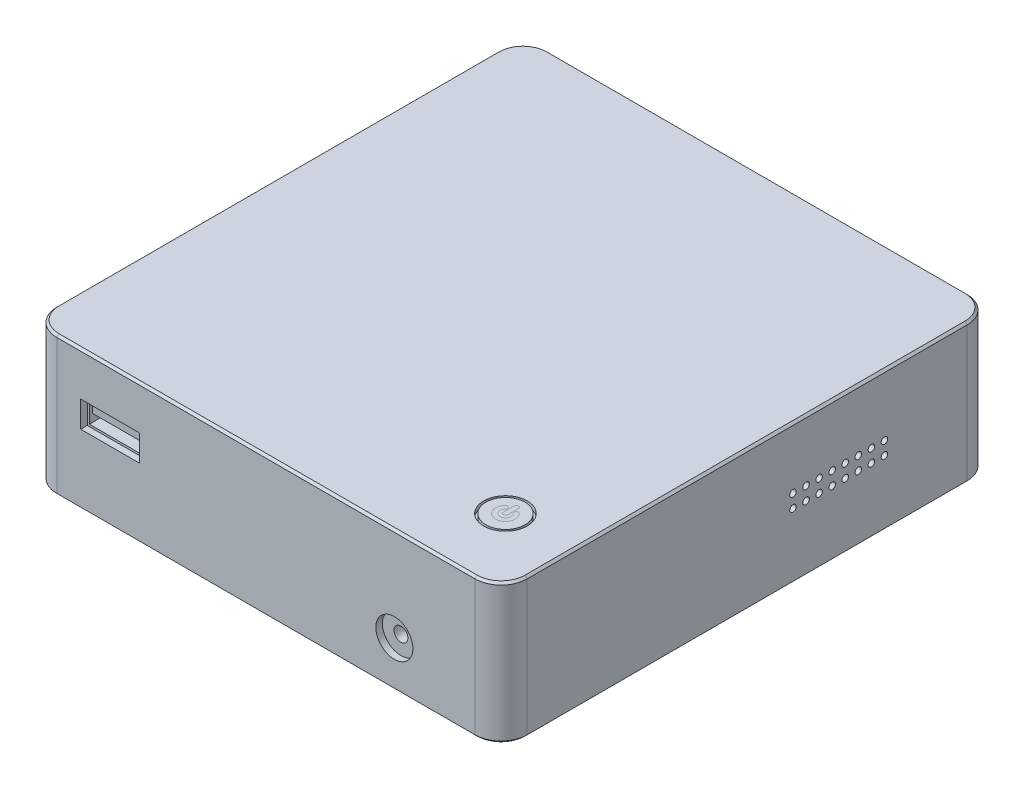
from build123d import *

# Parameters (mm, degrees)
EXTRUDE_1_DEPTH           = 32
SKETCH_2_R                = 5
SKETCH_2_R_2              = 4.5
CUT_EXTRUDE_1_DEPTH       = 1
SKETCH_4_R                = 0.75
CUT_EXTRUDE_2_DEPTH       = 3
SKETCH_5_R                = 4.25
SKETCH_5_W                = 13.5
SKETCH_5_H                = 6
CUT_EXTRUDE_3_DEPTH       = 1.5
SKETCH_6_R                = 1.6
SKETCH_6_W                = 12.5
SKETCH_6_H                = 5
SKETCH_6_W_2              = 11
SKETCH_6_H_2              = 2
CUT_EXTRUDE_4_DEPTH       = 10
SKETCH_7_W                = 13.5
SKETCH_7_H                = 6
CUT_EXTRUDE_5_DEPTH       = 1.5
SKETCH_8_W                = 12.5
SKETCH_8_H                = 5
SKETCH_8_W_2              = 11
SKETCH_8_H_2              = 2
CUT_EXTRUDE_6_DEPTH       = 10
SKETCH_9_R                = 5
CUT_EXTRUDE_7_DEPTH       = 1.5
SKETCH_10_R               = 3.25
SKETCH_10_R_2             = 1.25
SKETCH_10_W               = 7
SKETCH_10_H               = 2
CUT_EXTRUDE_8_DEPTH       = 10
SKETCH_11_W               = 1
SKETCH_11_H               = 8.8
CUT_EXTRUDE_9_DEPTH       = 10
HOLE_WIZARD_M3_1_D        = 2.5
HOLE_WIZARD_M3_1_DEPTH    = 7.5
HOLE_WIZARD_M3_1_TIP      = 0.751075774
SKETCH_14_R               = 5.5
EXTRUDE_2_DEPTH           = 2
EXTRUDE_2_DRAFT           = 10
EXTRUDE_2_PROFILE_2_DEPTH = 2
EXTRUDE_2_PROFILE_2_DRAFT = 10
EXTRUDE_2_PROFILE_3_DEPTH = 2
EXTRUDE_2_PROFILE_3_DRAFT = 10
EXTRUDE_2_PROFILE_4_DEPTH = 2
EXTRUDE_2_PROFILE_4_DRAFT = 10
CHAMFER_1_SIZE            = 0.5


with BuildPart() as part:
    # 草图1 → 凸台-拉伸1 (new body)
    with BuildSketch(Plane(origin=(0, 0, 0), x_dir=(1, 0, 0), z_dir=(0, 1, 0))):
        with BuildLine():
            Line((-48, -56.5), (48, -56.5))
            ThreePointArc((48, -56.5), (52.242640687, -54.742640687), (54, -50.5))
            Line((54, -50.5), (54, 50.5))
            ThreePointArc((54, 50.5), (52.242640687, 54.742640687), (48, 56.5))
            Line((48, 56.5), (-48, 56.5))
            ThreePointArc((-48, 56.5), (-52.242640687, 54.742640687), (-54, 50.5))
            Line((-54, 50.5), (-54, -50.5))
            ThreePointArc((-54, -50.5), (-52.242640687, -54.742640687), (-48, -56.5))
        make_face()
    extrude(amount=EXTRUDE_1_DEPTH)

    # 草图2 → 切除-拉伸1 (cut)
    with BuildSketch(Plane(origin=(0, 32, 0), x_dir=(1, 0, 0), z_dir=(0, 1, 0))):
        with Locations(Location((39, -40.5, 0), (0, 0, 270))):
            Circle(SKETCH_2_R)
        with Locations(Location((39, -40.5, 0), (0, 0, 270))):
            Circle(SKETCH_2_R_2, mode=Mode.SUBTRACT)
    extrude(amount=-CUT_EXTRUDE_1_DEPTH, mode=Mode.SUBTRACT)

    # 草图4 → 切除-拉伸2 (cut)
    with BuildSketch(Plane(origin=(54, 0, 0), x_dir=(0, 0, -1), z_dir=(1, 0, 0))):
        with Locations((10.5, 18)):
            Circle(SKETCH_4_R)
        with Locations((13.5, 18)):
            Circle(SKETCH_4_R)
        with Locations((16.5, 18)):
            Circle(SKETCH_4_R)
        with Locations((19.5, 18)):
            Circle(SKETCH_4_R)
        with Locations((22.5, 18)):
            Circle(SKETCH_4_R)
        with Locations((25.5, 18)):
            Circle(SKETCH_4_R)
        with Locations((28.5, 18)):
            Circle(SKETCH_4_R)
        with Locations((31.5, 18)):
            Circle(SKETCH_4_R)
        with Locations((13.5, 15)):
            Circle(SKETCH_4_R)
        with Locations((16.5, 15)):
            Circle(SKETCH_4_R)
        with Locations((19.5, 15)):
            Circle(SKETCH_4_R)
        with Locations((22.5, 15)):
            Circle(SKETCH_4_R)
        with Locations((25.5, 15)):
            Circle(SKETCH_4_R)
        with Locations((28.5, 15)):
            Circle(SKETCH_4_R)
        with Locations((31.5, 15)):
            Circle(SKETCH_4_R)
        with Locations((10.5, 15)):
            Circle(SKETCH_4_R)
    extrude(amount=-CUT_EXTRUDE_2_DEPTH, mode=Mode.SUBTRACT)

    # 草图5 → 切除-拉伸3 (cut)
    with BuildSketch(Plane.XY.offset(56.5)):
        with Locations((29.5, 10.5)):
            Circle(SKETCH_5_R)
        with Locations((-35.75, 19)):
            Rectangle(SKETCH_5_W, SKETCH_5_H)
    extrude(amount=-CUT_EXTRUDE_3_DEPTH, mode=Mode.SUBTRACT)

    # 草图6 → 切除-拉伸4 (cut)
    # profile 1 of 2: a face of its own
    with BuildSketch(Plane.XY.offset(55)):
        with Locations((29.5, 10.5)):
            Circle(SKETCH_6_R)
    # profile 2 of 2: a face of its own
    with BuildSketch(Plane.XY.offset(55)):
        with Locations((-35.75, 19)):
            Rectangle(SKETCH_6_W, SKETCH_6_H)
        with Locations((-35.75, 20)):
            Rectangle(SKETCH_6_W_2, SKETCH_6_H_2, mode=Mode.SUBTRACT)
    extrude(amount=-CUT_EXTRUDE_4_DEPTH, mode=Mode.SUBTRACT)

    # 草图7 → 切除-拉伸5 (cut)
    with BuildSketch(Plane.ZY.offset(54)):
        with Locations((3.25, 19)):
            Rectangle(SKETCH_7_W, SKETCH_7_H)
        with Locations((25.75, 19)):
            Rectangle(SKETCH_7_W, SKETCH_7_H)
    extrude(amount=-CUT_EXTRUDE_5_DEPTH, mode=Mode.SUBTRACT)

    # 草图8 → 切除-拉伸6 (cut)
    # profile 1 of 2: a face of its own
    with BuildSketch(Plane.ZY.offset(52.5)):
        with Locations((3.25, 19)):
            Rectangle(SKETCH_8_W, SKETCH_8_H)
        with Locations((3.25, 20)):
            Rectangle(SKETCH_8_W_2, SKETCH_8_H_2, mode=Mode.SUBTRACT)
    # profile 2 of 2: a face of its own
    with BuildSketch(Plane.ZY.offset(52.5)):
        with Locations((25.75, 19)):
            Rectangle(SKETCH_8_W, SKETCH_8_H)
        with Locations((25.75, 20)):
            Rectangle(SKETCH_8_W_2, SKETCH_8_H_2, mode=Mode.SUBTRACT)
    extrude(amount=-CUT_EXTRUDE_6_DEPTH, mode=Mode.SUBTRACT)

    # 草图9 → 切除-拉伸7 (cut)
    with BuildSketch(Plane(origin=(0, 0, -56.5), x_dir=(-1, 0, 0), z_dir=(0, 0, -1))):
        with Locations((-39, 9.5)):
            Circle(SKETCH_9_R)
        with BuildLine():
            Line((-27.5, 7), (-14.5, 7))
            ThreePointArc((-14.5, 7), (-13.792893219, 7.292893219), (-13.5, 8))
            Line((-13.5, 8), (-13.5, 9.585786438))
            ThreePointArc((-13.5, 9.585786438), (-13.576120467, 9.96846987), (-13.792893219, 10.292893219))
            Line((-13.792893219, 10.292893219), (-15.707106781, 12.207106781))
            ThreePointArc((-15.707106781, 12.207106781), (-16.03153013, 12.423879533), (-16.414213562, 12.5))
            Line((-16.414213562, 12.5), (-25.585786438, 12.5))
            ThreePointArc((-25.585786438, 12.5), (-25.96846987, 12.423879533), (-26.292893219, 12.207106781))
            Line((-26.292893219, 12.207106781), (-28.207106781, 10.292893219))
            ThreePointArc((-28.207106781, 10.292893219), (-28.423879533, 9.96846987), (-28.5, 9.585786438))
            Line((-28.5, 9.585786438), (-28.5, 8))
            ThreePointArc((-28.5, 8), (-28.207106781, 7.292893219), (-27.5, 7))
        make_face()
        with BuildLine():
            Line((-44.8, 23), (-39.8, 23))
            ThreePointArc((-39.8, 23), (-39.092893219, 22.707106781), (-38.8, 22))
            Line((-38.8, 22), (-38.8, 21))
            ThreePointArc((-38.8, 21), (-39.092893219, 20.292893219), (-39.8, 20))
            Line((-39.8, 20), (-44.8, 20))
            ThreePointArc((-44.8, 20), (-45.507106781, 20.292893219), (-45.8, 21))
            Line((-45.8, 21), (-45.8, 22))
            ThreePointArc((-45.8, 22), (-45.507106781, 22.707106781), (-44.8, 23))
        make_face()
        with BuildLine():
            Line((-36, 26.5), (-9.5, 26.5))
            ThreePointArc((-9.5, 26.5), (-8.792893219, 26.207106781), (-8.5, 25.5))
            Line((-8.5, 25.5), (-8.5, 18.7))
            ThreePointArc((-8.5, 18.7), (-8.792893219, 17.992893219), (-9.5, 17.7))
            Line((-9.5, 17.7), (-36, 17.7))
            ThreePointArc((-36, 17.7), (-36.707106781, 17.992893219), (-37, 18.7))
            Line((-37, 18.7), (-37, 25.5))
            ThreePointArc((-37, 25.5), (-36.707106781, 26.207106781), (-36, 26.5))
        make_face()
        with BuildLine():
            Line((-5.5, 26.5), (21, 26.5))
            ThreePointArc((21, 26.5), (21.707106781, 26.207106781), (22, 25.5))
            Line((22, 25.5), (22, 18.7))
            ThreePointArc((22, 18.7), (21.707106781, 17.992893219), (21, 17.7))
            Line((21, 17.7), (-5.5, 17.7))
            ThreePointArc((-5.5, 17.7), (-6.207106781, 17.992893219), (-6.5, 18.7))
            Line((-6.5, 18.7), (-6.5, 25.5))
            ThreePointArc((-6.5, 25.5), (-6.207106781, 26.207106781), (-5.5, 26.5))
        make_face()
        with BuildLine():
            Line((29, 21.7), (40.5, 21.7))
            ThreePointArc((40.5, 21.7), (41.207106781, 21.407106781), (41.5, 20.7))
            Line((41.5, 20.7), (41.5, 10.2))
            ThreePointArc((41.5, 10.2), (40.621320344, 8.078679656), (38.5, 7.2))
            Line((38.5, 7.2), (31, 7.2))
            ThreePointArc((31, 7.2), (28.878679656, 8.078679656), (28, 10.2))
            Line((28, 10.2), (28, 20.7))
            ThreePointArc((28, 20.7), (28.292893219, 21.407106781), (29, 21.7))
        make_face()
        with BuildLine():
            Line((12.042893219, 4.607106781), (12.457106781, 4.192893219))
            ThreePointArc((12.457106781, 4.192893219), (12.78153013, 3.976120467), (13.164213562, 3.9))
            Line((13.164213562, 3.9), (17.335786438, 3.9))
            ThreePointArc((17.335786438, 3.9), (17.71846987, 3.976120467), (18.042893219, 4.192893219))
            Line((18.042893219, 4.192893219), (18.457106781, 4.607106781))
            ThreePointArc((18.457106781, 4.607106781), (18.78153013, 4.823879533), (19.164213562, 4.9))
            Line((19.164213562, 4.9), (21, 4.9))
            ThreePointArc((21, 4.9), (21.707106781, 5.192893219), (22, 5.9))
            Line((22, 5.9), (22, 13.7))
            ThreePointArc((22, 13.7), (21.707106781, 14.407106781), (21, 14.7))
            Line((21, 14.7), (9.5, 14.7))
            ThreePointArc((9.5, 14.7), (8.792893219, 14.407106781), (8.5, 13.7))
            Line((8.5, 13.7), (8.5, 5.9))
            ThreePointArc((8.5, 5.9), (8.792893219, 5.192893219), (9.5, 4.9))
            Line((9.5, 4.9), (11.335786438, 4.9))
            ThreePointArc((11.335786438, 4.9), (11.71846987, 4.823879533), (12.042893219, 4.607106781))
        make_face()
        with BuildLine():
            Line((-5, 13.7), (1.5, 13.7))
            ThreePointArc((1.5, 13.7), (2.207106781, 13.407106781), (2.5, 12.7))
            Line((2.5, 12.7), (2.5, 9.2))
            ThreePointArc((2.5, 9.2), (2.207106781, 8.492893219), (1.5, 8.2))
            Line((1.5, 8.2), (-5, 8.2))
            ThreePointArc((-5, 8.2), (-5.707106781, 8.492893219), (-6, 9.2))
            Line((-6, 9.2), (-6, 12.7))
            ThreePointArc((-6, 12.7), (-5.707106781, 13.407106781), (-5, 13.7))
        make_face()
    extrude(amount=-CUT_EXTRUDE_7_DEPTH, mode=Mode.SUBTRACT)

    # 草图10 → 切除-拉伸8 (cut)
    # profile 1 of 7: a face of its own
    with BuildSketch(Plane(origin=(0, 0, -55), x_dir=(-1, 0, 0), z_dir=(0, 0, -1))):
        with Locations((-39, 9.5)):
            Circle(SKETCH_10_R)
        with Locations((-39, 9.5)):
            Circle(SKETCH_10_R_2, mode=Mode.SUBTRACT)
    # profile 2 of 7: a face of its own
    with BuildSketch(Plane(origin=(0, 0, -55), x_dir=(-1, 0, 0), z_dir=(0, 0, -1))):
        with BuildLine():
            Line((-38.8, 21), (-38.8, 22))
            ThreePointArc((-38.8, 22), (-39.092893219, 22.707106781), (-39.8, 23))
            Line((-39.8, 23), (-44.8, 23))
            ThreePointArc((-44.8, 23), (-45.507106781, 22.707106781), (-45.8, 22))
            Line((-45.8, 22), (-45.8, 21))
            ThreePointArc((-45.8, 21), (-45.507106781, 20.292893219), (-44.8, 20))
            Line((-44.8, 20), (-39.8, 20))
            ThreePointArc((-39.8, 20), (-39.092893219, 20.292893219), (-38.8, 21))
        make_face()
    # profile 3 of 7: a face of its own
    with BuildSketch(Plane(origin=(0, 0, -55), x_dir=(-1, 0, 0), z_dir=(0, 0, -1))):
        with BuildLine():
            Line((-27.5, 7.5), (-14.5, 7.5))
            ThreePointArc((-14.5, 7.5), (-14.146446609, 7.646446609), (-14, 8))
            Line((-14, 8), (-14, 9.585786438))
            ThreePointArc((-14, 9.585786438), (-14.038060234, 9.777128154), (-14.146446609, 9.939339828))
            Line((-14.146446609, 9.939339828), (-16.060660172, 11.853553391))
            ThreePointArc((-16.060660172, 11.853553391), (-16.222871846, 11.961939766), (-16.414213562, 12))
            Line((-16.414213562, 12), (-25.585786438, 12))
            ThreePointArc((-25.585786438, 12), (-25.777128154, 11.961939766), (-25.939339828, 11.853553391))
            Line((-25.939339828, 11.853553391), (-27.853553391, 9.939339828))
            ThreePointArc((-27.853553391, 9.939339828), (-27.961939766, 9.777128154), (-28, 9.585786438))
            Line((-28, 9.585786438), (-28, 8))
            ThreePointArc((-28, 8), (-27.853553391, 7.646446609), (-27.5, 7.5))
        make_face()
        with BuildLine():
            Line((-25.5, 9.835786438), (-16.5, 9.835786438))
            ThreePointArc((-16.5, 9.835786438), (-16.25, 9.585786438), (-16.5, 9.335786438))
            Line((-16.5, 9.335786438), (-25.5, 9.335786438))
            ThreePointArc((-25.5, 9.335786438), (-25.75, 9.585786438), (-25.5, 9.835786438))
        make_face(mode=Mode.SUBTRACT)
    # profile 4 of 7: a face of its own
    with BuildSketch(Plane(origin=(0, 0, -55), x_dir=(-1, 0, 0), z_dir=(0, 0, -1))):
        with BuildLine():
            Line((10, 14.2), (20.5, 14.2))
            ThreePointArc((20.5, 14.2), (20.853553391, 14.053553391), (21, 13.7))
            Line((21, 13.7), (21, 6.7))
            ThreePointArc((21, 6.7), (20.853553391, 6.346446609), (20.5, 6.2))
            Line((20.5, 6.2), (17.25, 6.2))
            Line((17.25, 6.2), (17.25, 3.9))
            Line((17.25, 3.9), (13.25, 3.9))
            Line((13.25, 3.9), (13.25, 6.2))
            Line((13.25, 6.2), (10, 6.2))
            ThreePointArc((10, 6.2), (9.646446609, 6.346446609), (9.5, 6.7))
            Line((9.5, 6.7), (9.5, 13.7))
            ThreePointArc((9.5, 13.7), (9.646446609, 14.053553391), (10, 14.2))
        make_face()
    # profile 5 of 7: a face of its own
    with BuildSketch(Plane(origin=(0, 0, -55), x_dir=(-1, 0, 0), z_dir=(0, 0, -1))):
        with BuildLine():
            Line((2, 9.2), (2, 12.7))
            ThreePointArc((2, 12.7), (1.853553391, 13.053553391), (1.5, 13.2))
            Line((1.5, 13.2), (-5, 13.2))
            ThreePointArc((-5, 13.2), (-5.353553391, 13.053553391), (-5.5, 12.7))
            Line((-5.5, 12.7), (-5.5, 9.2))
            ThreePointArc((-5.5, 9.2), (-5.353553391, 8.846446609), (-5, 8.7))
            Line((-5, 8.7), (1.5, 8.7))
            ThreePointArc((1.5, 8.7), (1.853553391, 8.846446609), (2, 9.2))
        make_face()
        with Locations((-1.75, 10.95)):
            Rectangle(SKETCH_10_W, SKETCH_10_H, mode=Mode.SUBTRACT)
    # profile 6 of 7: a face of its own
    with BuildSketch(Plane(origin=(0, 0, -55), x_dir=(-1, 0, 0), z_dir=(0, 0, -1))):
        with BuildLine():
            Line((29, 20.7), (40.5, 20.7))
            ThreePointArc((40.5, 20.7), (40.853553391, 20.553553391), (41, 20.2))
            Line((41, 20.2), (41, 16.2))
            ThreePointArc((41, 16.2), (40.853553391, 15.846446609), (40.5, 15.7))
            Line((40.5, 15.7), (29, 15.7))
            ThreePointArc((29, 15.7), (28.646446609, 15.846446609), (28.5, 16.2))
            Line((28.5, 16.2), (28.5, 20.2))
            ThreePointArc((28.5, 20.2), (28.646446609, 20.553553391), (29, 20.7))
        make_face()
        with BuildLine():
            Line((29.75, 20.2), (39.75, 20.2))
            ThreePointArc((39.75, 20.2), (40.103553391, 20.053553391), (40.25, 19.7))
            Line((40.25, 19.7), (40.25, 18.7))
            ThreePointArc((40.25, 18.7), (40.103553391, 18.346446609), (39.75, 18.2))
            Line((39.75, 18.2), (29.75, 18.2))
            ThreePointArc((29.75, 18.2), (29.396446609, 18.346446609), (29.25, 18.7))
            Line((29.25, 18.7), (29.25, 19.7))
            ThreePointArc((29.25, 19.7), (29.396446609, 20.053553391), (29.75, 20.2))
        make_face(mode=Mode.SUBTRACT)
    # profile 7 of 7: a face of its own
    with BuildSketch(Plane(origin=(0, 0, -55), x_dir=(-1, 0, 0), z_dir=(0, 0, -1))):
        with BuildLine():
            Line((31.75, 13.2), (37.75, 13.2))
            ThreePointArc((37.75, 13.2), (39.25, 11.7), (37.75, 10.2))
            Line((37.75, 10.2), (31.75, 10.2))
            ThreePointArc((31.75, 10.2), (30.25, 11.7), (31.75, 13.2))
        make_face()
        with BuildLine():
            Line((31.75, 11.95), (37.75, 11.95))
            ThreePointArc((37.75, 11.95), (38, 11.7), (37.75, 11.45))
            Line((37.75, 11.45), (31.75, 11.45))
            ThreePointArc((31.75, 11.45), (31.5, 11.7), (31.75, 11.95))
        make_face(mode=Mode.SUBTRACT)
    extrude(amount=-CUT_EXTRUDE_8_DEPTH, mode=Mode.SUBTRACT)

    # 草图11 → 切除-拉伸9 (cut)
    with BuildSketch(Plane(origin=(0, 0, -55), x_dir=(-1, 0, 0), z_dir=(0, 0, -1))):
        with Locations((-35.5, 22.1)):
            Rectangle(SKETCH_11_W, SKETCH_11_H)
        with Locations((-33.538461538, 22.1)):
            Rectangle(SKETCH_11_W, SKETCH_11_H)
        with Locations((-31.576923077, 22.1)):
            Rectangle(SKETCH_11_W, SKETCH_11_H)
        with Locations((-29.615384615, 22.1)):
            Rectangle(SKETCH_11_W, SKETCH_11_H)
        with Locations((-27.653846154, 22.1)):
            Rectangle(SKETCH_11_W, SKETCH_11_H)
        with Locations((-25.692307692, 22.1)):
            Rectangle(SKETCH_11_W, SKETCH_11_H)
        with Locations((-23.730769231, 22.1)):
            Rectangle(SKETCH_11_W, SKETCH_11_H)
        with Locations((-21.769230769, 22.1)):
            Rectangle(SKETCH_11_W, SKETCH_11_H)
        with Locations((-19.807692308, 22.1)):
            Rectangle(SKETCH_11_W, SKETCH_11_H)
        with Locations((-17.846153846, 22.1)):
            Rectangle(SKETCH_11_W, SKETCH_11_H)
        with Locations((-15.884615385, 22.1)):
            Rectangle(SKETCH_11_W, SKETCH_11_H)
        with Locations((-13.923076923, 22.1)):
            Rectangle(SKETCH_11_W, SKETCH_11_H)
        with Locations((-11.961538462, 22.1)):
            Rectangle(SKETCH_11_W, SKETCH_11_H)
        with Locations((-10, 22.1)):
            Rectangle(SKETCH_11_W, SKETCH_11_H)
        with Locations((-5, 22.1)):
            Rectangle(SKETCH_11_W, SKETCH_11_H)
        with Locations((-3.038461538, 22.1)):
            Rectangle(SKETCH_11_W, SKETCH_11_H)
        with Locations((-1.076923077, 22.1)):
            Rectangle(SKETCH_11_W, SKETCH_11_H)
        with Locations((0.884615385, 22.1)):
            Rectangle(SKETCH_11_W, SKETCH_11_H)
        with Locations((2.846153846, 22.1)):
            Rectangle(SKETCH_11_W, SKETCH_11_H)
        with Locations((4.807692308, 22.1)):
            Rectangle(SKETCH_11_W, SKETCH_11_H)
        with Locations((6.769230769, 22.1)):
            Rectangle(SKETCH_11_W, SKETCH_11_H)
        with Locations((8.730769231, 22.1)):
            Rectangle(SKETCH_11_W, SKETCH_11_H)
        with Locations((10.692307692, 22.1)):
            Rectangle(SKETCH_11_W, SKETCH_11_H)
        with Locations((12.653846154, 22.1)):
            Rectangle(SKETCH_11_W, SKETCH_11_H)
        with Locations((14.615384615, 22.1)):
            Rectangle(SKETCH_11_W, SKETCH_11_H)
        with Locations((16.576923077, 22.1)):
            Rectangle(SKETCH_11_W, SKETCH_11_H)
        with Locations((18.538461538, 22.1)):
            Rectangle(SKETCH_11_W, SKETCH_11_H)
        with Locations((20.5, 22.1)):
            Rectangle(SKETCH_11_W, SKETCH_11_H)
    extrude(amount=-CUT_EXTRUDE_9_DEPTH, mode=Mode.SUBTRACT)

    # M3 螺纹孔1
    with Locations(Plane(origin=(0, 0, 0), x_dir=(-1, 0, 0), z_dir=(0, -1, 0))):
        with Locations((0, 40), (0, -40)):
            Hole(HOLE_WIZARD_M3_1_D / 2, depth=HOLE_WIZARD_M3_1_DEPTH)
            with Locations((0, 0, -(HOLE_WIZARD_M3_1_DEPTH + HOLE_WIZARD_M3_1_TIP / 2))):  # 118° drill point
                Cone(0, HOLE_WIZARD_M3_1_D / 2, HOLE_WIZARD_M3_1_TIP, mode=Mode.SUBTRACT)


with BuildPart() as extrude_2_tool:
    # 草图14 → 凸台-拉伸2 (with draft: the straight prism first)
    with BuildSketch(Plane.XZ):
        with Locations((-46, -48.5)):
            Circle(SKETCH_14_R)
    extrude(amount=EXTRUDE_2_DEPTH)
    # 凸台-拉伸2: the draft: its side faces are tilted about the plane it starts from
    extrude_2_sides = [extrude_2_tool.faces().sort_by_distance(p)[0] for p in [
        (-51.5, -1, -48.5),
    ]]
    draft(extrude_2_sides, Plane.XZ, EXTRUDE_2_DRAFT)


with BuildPart() as part_1:
    add(part.part)

    # 凸台-拉伸2: add extrude_2_tool
    add(extrude_2_tool.part)


with BuildPart() as extrude_2_profile_2_tool:
    # 草图14 → 凸台-拉伸2 profile 2 (with draft: the straight prism first)
    with BuildSketch(Plane.XZ):
        with Locations((-46, 48.5)):
            Circle(SKETCH_14_R)
    extrude(amount=EXTRUDE_2_PROFILE_2_DEPTH)
    # 凸台-拉伸2 profile 2: the draft: its side faces are tilted about the plane it starts from
    extrude_2_profile_2_sides = [extrude_2_profile_2_tool.faces().sort_by_distance(p)[0] for p in [
        (-51.5, -1, 48.5),
    ]]
    draft(extrude_2_profile_2_sides, Plane.XZ, EXTRUDE_2_PROFILE_2_DRAFT)


with BuildPart() as part_2:
    add(part_1.part)

    # 凸台-拉伸2 profile 2: add extrude_2_profile_2_tool
    add(extrude_2_profile_2_tool.part)


with BuildPart() as extrude_2_profile_3_tool:
    # 草图14 → 凸台-拉伸2 profile 3 (with draft: the straight prism first)
    with BuildSketch(Plane.XZ):
        with Locations((46, 48.5)):
            Circle(SKETCH_14_R)
    extrude(amount=EXTRUDE_2_PROFILE_3_DEPTH)
    # 凸台-拉伸2 profile 3: the draft: its side faces are tilted about the plane it starts from
    extrude_2_profile_3_sides = [extrude_2_profile_3_tool.faces().sort_by_distance(p)[0] for p in [
        (40.5, -1, 48.5),
    ]]
    draft(extrude_2_profile_3_sides, Plane.XZ, EXTRUDE_2_PROFILE_3_DRAFT)


with BuildPart() as part_3:
    add(part_2.part)

    # 凸台-拉伸2 profile 3: add extrude_2_profile_3_tool
    add(extrude_2_profile_3_tool.part)


with BuildPart() as extrude_2_profile_4_tool:
    # 草图14 → 凸台-拉伸2 profile 4 (with draft: the straight prism first)
    with BuildSketch(Plane.XZ):
        with Locations((46, -48.5)):
            Circle(SKETCH_14_R)
    extrude(amount=EXTRUDE_2_PROFILE_4_DEPTH)
    # 凸台-拉伸2 profile 4: the draft: its side faces are tilted about the plane it starts from
    extrude_2_profile_4_sides = [extrude_2_profile_4_tool.faces().sort_by_distance(p)[0] for p in [
        (40.5, -1, -48.5),
    ]]
    draft(extrude_2_profile_4_sides, Plane.XZ, EXTRUDE_2_PROFILE_4_DRAFT)


with BuildPart() as part_4:
    add(part_3.part)

    # 凸台-拉伸2 profile 4: add extrude_2_profile_4_tool
    add(extrude_2_profile_4_tool.part)

    # 倒角1
    chamfer_1_edges = [part_4.edges().sort_by_distance(p)[0] for p in [
        (52.242640687, 32, 54.742640687),
        (0, 0, 56.5),
        (-52.242640687, 0, 54.742640687),
        (54, 32, 0),
        (52.242640687, 32, -54.742640687),
        (0, 32, -56.5),
        (-52.242640687, 32, -54.742640687),
        (-54, 32, 0),
        (-52.242640687, 32, 54.742640687),
        (0, 32, 56.5),
        (-54, 0, 0),
        (-52.242640687, 0, -54.742640687),
        (0, 0, -56.5),
        (52.242640687, 0, -54.742640687),
        (54, 0, 0),
        (52.242640687, 0, 54.742640687),
    ]]
    chamfer(chamfer_1_edges, length=CHAMFER_1_SIZE)


solid = part_4.part
